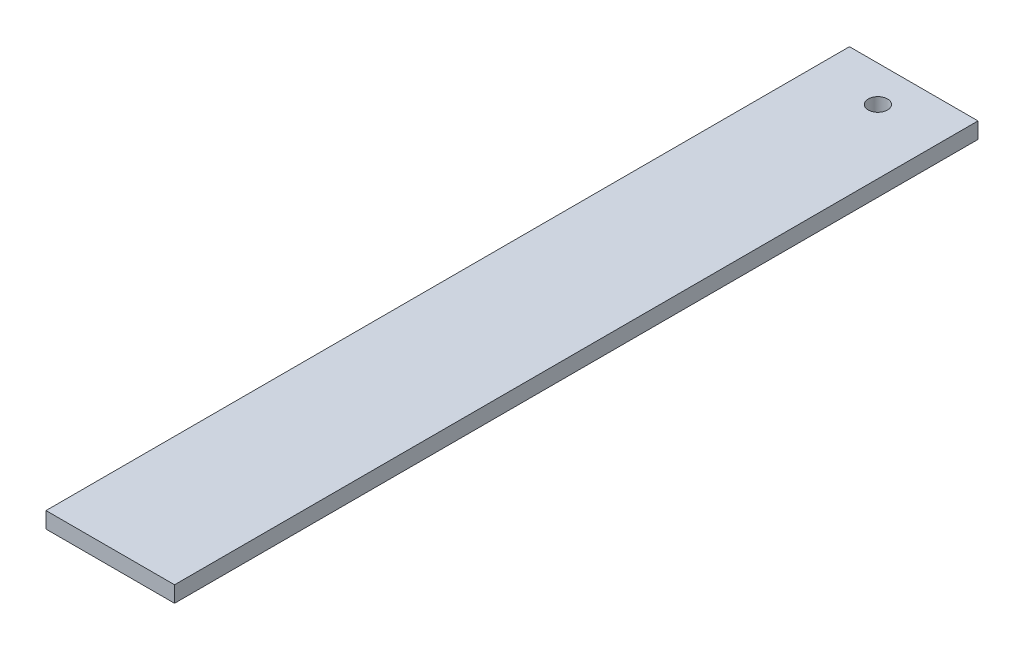
from build123d import *

# Parameters (mm, degrees)
SKETCH1_W           = 40
SKETCH1_H           = 250
SKETCH1_R           = 2.995074004
BOSS_EXTRUDE1_DEPTH = 5


with BuildPart() as part:
    # Sketch1 → Boss-Extrude1 (new body)
    with BuildSketch(Plane(origin=(0, 0, 0), x_dir=(1, 0, 0), z_dir=(0, 1, 0))):
        with Locations((20, -125)):
            Rectangle(SKETCH1_W, SKETCH1_H)
        with Locations(Location((20, -11.144873823, 0), (0, 0, 270))):
            Circle(SKETCH1_R, mode=Mode.SUBTRACT)
    extrude(amount=BOSS_EXTRUDE1_DEPTH)


solid = part.part
